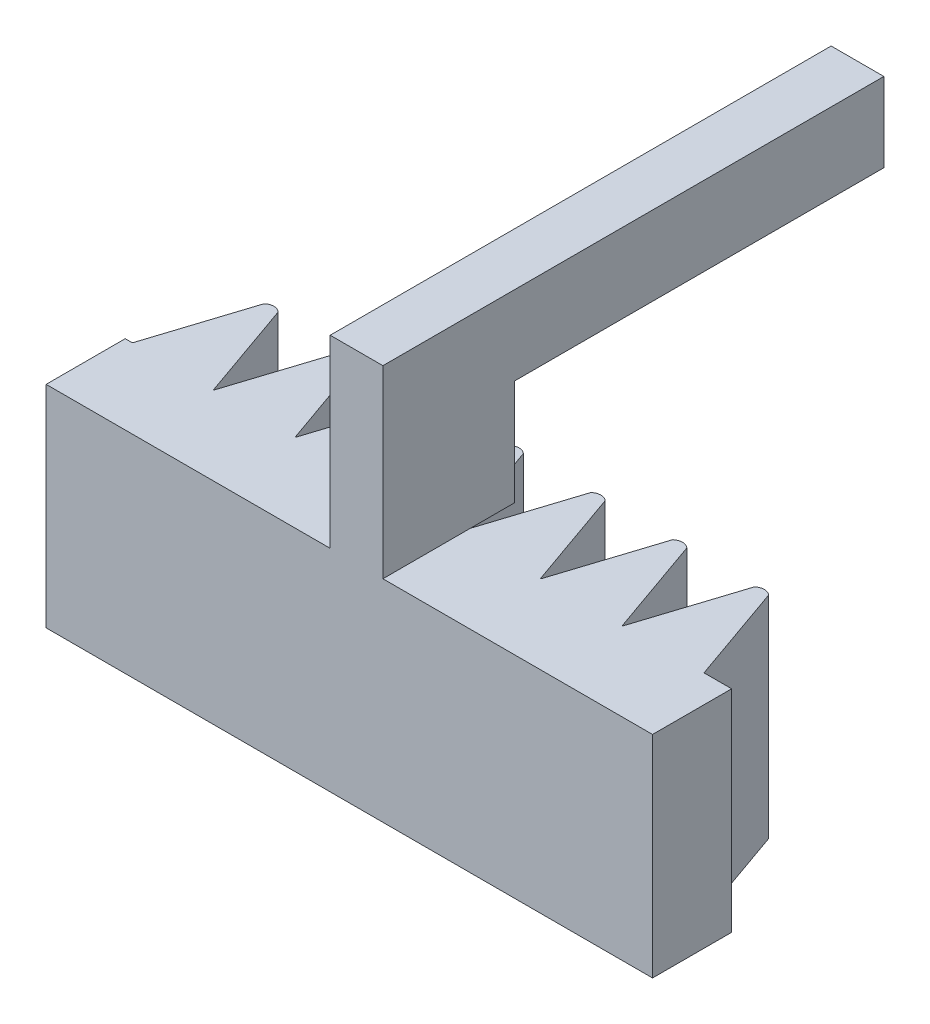
from build123d import *

# Parameters (mm, degrees)
BOSS_EXTRUDE1_DEPTH   = 8
BOSS_EXTRUDE1_2_DEPTH = 8
BOSS_EXTRUDE1_3_DEPTH = 8
BOSS_EXTRUDE1_4_DEPTH = 8
BOSS_EXTRUDE1_5_DEPTH = 8
BOSS_EXTRUDE1_6_DEPTH = 8
BOSS_EXTRUDE1_7_DEPTH = 8
BASE_W                = 23
BASE_H                = 3
BOSS_EXTRUDE2_DEPTH   = 8
SKETCH1_W             = 5
SKETCH1_H             = 7
BOSS_EXTRUDE3_DEPTH   = 2
SKETCH2_W             = 2
SKETCH2_H             = 3
BOSS_EXTRUDE4_DEPTH   = 14


with BuildPart() as part:
    # Gears-1 → Boss-Extrude1 (new body)
    with BuildSketch(Plane(origin=(0, 0, 0), x_dir=(1, 0, 0), z_dir=(0, 1, 0))):
        with BuildLine():
            Line((-0.500594601, 0), (0.709644096, 3.775809937))
            ThreePointArc((0.709644096, 3.775809937), (0.980506814, 3.882987586), (1.251369531, 3.775809937))
            Line((1.251369531, 3.775809937), (2.579049224, 0))
            Line((2.579049224, 0), (-0.500594601, 0))
        make_face()
    extrude(amount=BOSS_EXTRUDE1_DEPTH)



with BuildPart() as body_2:
    # Gears-1 → Boss-Extrude1 2 (new body)
    with BuildSketch(Plane(origin=(0, 0, 0), x_dir=(1, 0, 0), z_dir=(0, 1, 0))):
        with BuildLine():
            Line((2.599405399, 0), (5.679049224, 0))
            Line((5.679049224, 0), (4.351369531, 3.775809937))
            ThreePointArc((4.351369531, 3.775809937), (4.080506814, 3.882987586), (3.809644096, 3.775809937))
            Line((3.809644096, 3.775809937), (2.599405399, 0))
        make_face()
    extrude(amount=BOSS_EXTRUDE1_2_DEPTH)


with BuildPart() as body_3:
    # Gears-1 → Boss-Extrude1 3 (new body)
    with BuildSketch(Plane(origin=(0, 0, 0), x_dir=(1, 0, 0), z_dir=(0, 1, 0))):
        with BuildLine():
            Line((5.699405399, 0), (8.779049224, 0))
            Line((8.779049224, 0), (7.451369531, 3.775809937))
            ThreePointArc((7.451369531, 3.775809937), (7.180506814, 3.882987586), (6.909644096, 3.775809937))
            Line((6.909644096, 3.775809937), (5.699405399, 0))
        make_face()
    extrude(amount=BOSS_EXTRUDE1_3_DEPTH)


with BuildPart() as body_4:
    # Gears-1 → Boss-Extrude1 4 (new body)
    with BuildSketch(Plane(origin=(0, 0, 0), x_dir=(1, 0, 0), z_dir=(0, 1, 0))):
        with BuildLine():
            Line((8.799405399, 0), (11.879049224, 0))
            Line((11.879049224, 0), (10.551369531, 3.775809937))
            ThreePointArc((10.551369531, 3.775809937), (10.280506814, 3.882987586), (10.009644096, 3.775809937))
            Line((10.009644096, 3.775809937), (8.799405399, 0))
        make_face()
    extrude(amount=BOSS_EXTRUDE1_4_DEPTH)


with BuildPart() as body_5:
    # Gears-1 → Boss-Extrude1 5 (new body)
    with BuildSketch(Plane(origin=(0, 0, 0), x_dir=(1, 0, 0), z_dir=(0, 1, 0))):
        with BuildLine():
            Line((11.899405399, 0), (14.979049224, 0))
            Line((14.979049224, 0), (13.651369531, 3.775809937))
            ThreePointArc((13.651369531, 3.775809937), (13.380506814, 3.882987586), (13.109644096, 3.775809937))
            Line((13.109644096, 3.775809937), (11.899405399, 0))
        make_face()
    extrude(amount=BOSS_EXTRUDE1_5_DEPTH)


with BuildPart() as body_6:
    # Gears-1 → Boss-Extrude1 6 (new body)
    with BuildSketch(Plane(origin=(0, 0, 0), x_dir=(1, 0, 0), z_dir=(0, 1, 0))):
        with BuildLine():
            Line((14.999405399, 0), (18.079049224, 0))
            Line((18.079049224, 0), (16.751369531, 3.775809937))
            ThreePointArc((16.751369531, 3.775809937), (16.480506814, 3.882987586), (16.209644096, 3.775809937))
            Line((16.209644096, 3.775809937), (14.999405399, 0))
        make_face()
    extrude(amount=BOSS_EXTRUDE1_6_DEPTH)


with BuildPart() as body_7:
    # Gears-1 → Boss-Extrude1 7 (new body)
    with BuildSketch(Plane(origin=(0, 0, 0), x_dir=(1, 0, 0), z_dir=(0, 1, 0))):
        with BuildLine():
            Line((18.099405399, 0), (21.179049224, 0))
            Line((21.179049224, 0), (19.851369531, 3.775809937))
            ThreePointArc((19.851369531, 3.775809937), (19.580506814, 3.882987586), (19.309644096, 3.775809937))
            Line((19.309644096, 3.775809937), (18.099405399, 0))
        make_face()
    extrude(amount=BOSS_EXTRUDE1_7_DEPTH)


with BuildPart() as part_1:
    add(part.part)

    add(body_2.part)  # Boss-Extrude2 merges body 2

    add(body_3.part)  # Boss-Extrude2 merges body 3

    add(body_4.part)  # Boss-Extrude2 merges body 4

    add(body_5.part)  # Boss-Extrude2 merges body 5

    add(body_6.part)  # Boss-Extrude2 merges body 6

    add(body_7.part)  # Boss-Extrude2 merges body 7
    # Base → Boss-Extrude2 (add)
    with BuildSketch(Plane(origin=(0, 0, 0), x_dir=(1, 0, 0), z_dir=(0, 1, 0))):
        with Locations((10.726532056, -1.5)):
            Rectangle(BASE_W, BASE_H)
    extrude(amount=BOSS_EXTRUDE2_DEPTH)

    # Sketch1 → Boss-Extrude3 (add)
    with BuildSketch(Plane(origin=(10, 0, 0), x_dir=(0, 0, -1), z_dir=(1, 0, 0))):
        with Locations((-0.5, 11.5)):
            Rectangle(SKETCH1_W, SKETCH1_H)
    extrude(amount=BOSS_EXTRUDE3_DEPTH)

    # Sketch2 → Boss-Extrude4 (add)
    with BuildSketch(Plane(origin=(0, 0, -2), x_dir=(-1, 0, 0), z_dir=(0, 0, -1))):
        with Locations((-11, 13.5)):
            Rectangle(SKETCH2_W, SKETCH2_H)
    extrude(amount=BOSS_EXTRUDE4_DEPTH)


solid = part_1.part
